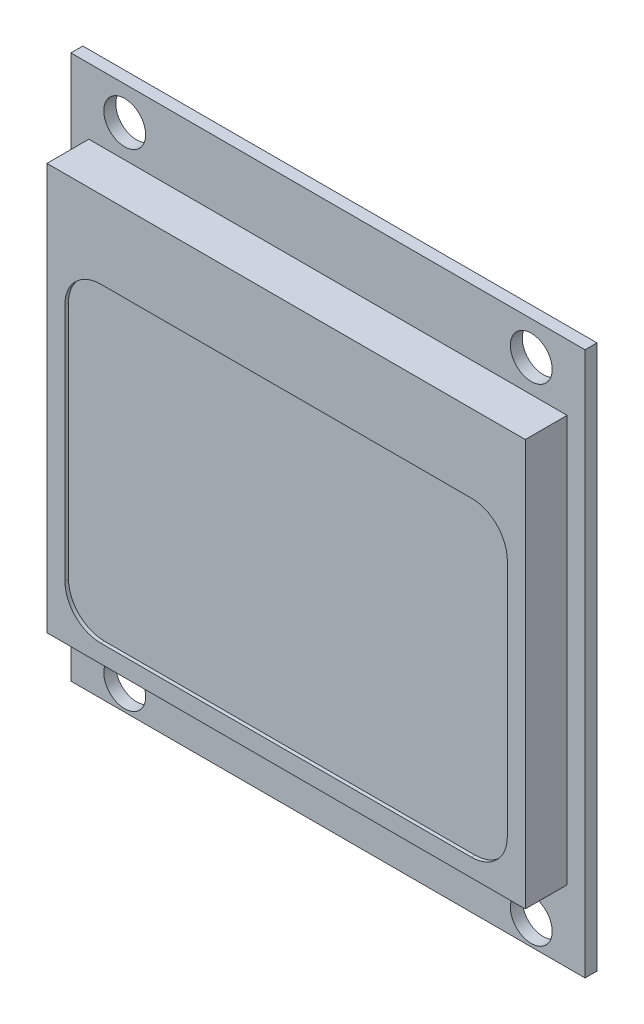
from build123d import *

# Parameters (mm, degrees)
SKETCH1_W           = 43
SKETCH1_H           = 45.5
SKETCH1_R           = 1.75
BOSS_EXTRUDE1_DEPTH = 1
SKETCH2_W           = 40
SKETCH2_H           = 34
BOSS_EXTRUDE2_DEPTH = 3.5
CUT_EXTRUDE1_DEPTH  = 0.3


with BuildPart() as part:
    # Sketch1 → Boss-Extrude1 (new body)
    with BuildSketch(Plane.XY):
        Rectangle(SKETCH1_W, SKETCH1_H)
        with Locations((-17, 19.95)):
            Circle(SKETCH1_R, mode=Mode.SUBTRACT)
        with Locations((17, 19.95)):
            Circle(SKETCH1_R, mode=Mode.SUBTRACT)
        with Locations((-17, -20.75)):
            Circle(SKETCH1_R, mode=Mode.SUBTRACT)
        with Locations((17, -20.75)):
            Circle(SKETCH1_R, mode=Mode.SUBTRACT)
    extrude(amount=BOSS_EXTRUDE1_DEPTH)

    # Sketch2 → Boss-Extrude2 (add)
    with BuildSketch(Plane.XY.offset(1)):
        with Locations((0, 0.25)):
            Rectangle(SKETCH2_W, SKETCH2_H)
    extrude(amount=BOSS_EXTRUDE2_DEPTH)

    # Sketch3 → Cut-Extrude1 (cut)
    with BuildSketch(Plane.XY.offset(4.5)):
        with BuildLine():
            Line((-15.5, 10.75), (15.5, 10.75))
            ThreePointArc((15.5, 10.75), (17.621320344, 9.871320344), (18.5, 7.75))
            Line((18.5, 7.75), (18.5, -12.25))
            ThreePointArc((18.5, -12.25), (17.621320344, -14.371320344), (15.5, -15.25))
            Line((15.5, -15.25), (-15.5, -15.25))
            ThreePointArc((-15.5, -15.25), (-17.621320344, -14.371320344), (-18.5, -12.25))
            Line((-18.5, -12.25), (-18.5, 7.75))
            ThreePointArc((-18.5, 7.75), (-17.621320344, 9.871320344), (-15.5, 10.75))
        make_face()
    extrude(amount=-CUT_EXTRUDE1_DEPTH, mode=Mode.SUBTRACT)


solid = part.part
